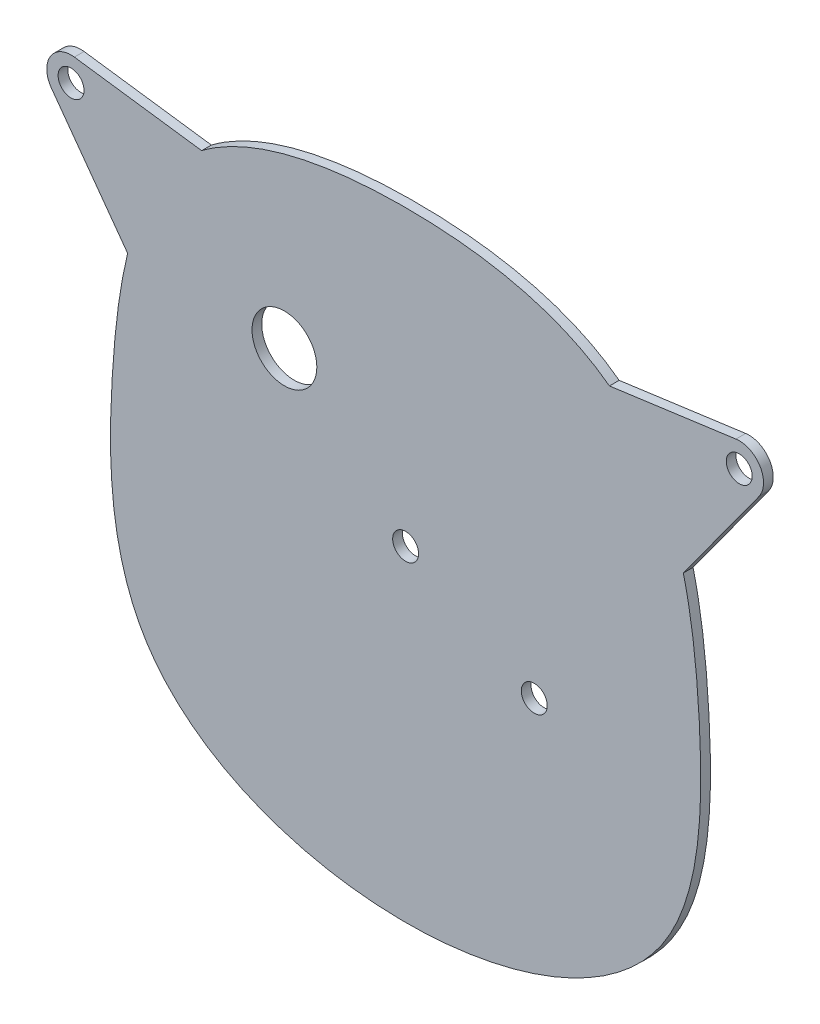
from build123d import *

# Parameters (mm, degrees)
SKETCH_1_R      = 4
SKETCH_1_R_2    = 4.000000012
SKETCH_1_R_3    = 10
EXTRUDE_1_DEPTH = 3


with BuildPart() as part:
    # 草图1 → 凸台-拉伸1 (new body)
    with BuildSketch(Plane.XY):
        with BuildLine():
            Line((-62.946774797, 79.306167048), (-102.215997093, 84.667287467))
            ThreePointArc((-102.215997093, 84.667287467), (-109.667345952, 81.085511319), (-109.297018411, 72.826299631))
            Line((-109.297018411, 72.826299631), (-85.773566925, 40.466210689))
            add(Edge.make_bspline(
                [(85.64855235, 40.771529883), (85.751941961, 40.352602987), (87.358023565, 33.693342831), (88.982133552, 23.461345128), (90.188940434, 10.112723309), (90.998385864, -3.239786605), (91.224047588, -19.81992963), (89.45776693, -35.608509018), (86.289368115, -47.383289507), (82.890059004, -55.67828953), (78.293434935, -63.325052227), (70.539270556, -72.418413989), (58.266934343, -81.71794177), (40.505578091, -89.639515513), (20.741493056, -94.38344306), (-0.025039607, -95.967725873), (-20.791572271, -94.38344306), (-40.555657306, -89.639515513), (-58.317013558, -81.71794177), (-70.589349771, -72.418413989), (-78.34351415, -63.325052227), (-82.940138219, -55.67828953), (-86.339447329, -47.383289507), (-89.507846145, -35.608509018), (-91.274126803, -19.81992963), (-91.048465079, -3.239786605), (-90.239019649, 10.112723309), (-89.032212767, 23.461345128), (-87.425045036, 33.586605521), (-85.851109178, 40.148511531), (-85.773566925, 40.466210689)],
                knots=[1.185395253, 1.185395253, 1.185395253, 1.185395253, 1.1875, 1.21875, 1.234375, 1.25, 1.28125, 1.3125, 1.328125, 1.34375, 1.359375, 1.375, 1.40625, 1.4375, 1.46875, 1.5, 1.53125, 1.5625, 1.59375, 1.625, 1.640625, 1.65625, 1.671875, 1.6875, 1.71875, 1.75, 1.765625, 1.78125, 1.8125, 1.814093804, 1.814093804, 1.814093804, 1.814093804], degree=3))
            Line((85.64855235, 40.771529883), (108.950058788, 72.826299629))
            ThreePointArc((108.950058788, 72.826299629), (109.320386334, 81.085511321), (101.869037469, 84.667287469))
            Line((101.869037469, 84.667287469), (62.85120424, 79.340487236))
            add(Edge.make_bspline(
                [(-62.946774797, 79.306167048), (-60.970021917, 80.799098941), (-53.878326947, 85.444266717), (-39.916439807, 91.111737151), (-20.474972643, 94.85291998), (-6.841683952, 95.560368398), (-0.025039607, 95.560368398), (6.791604738, 95.560368398), (20.424893428, 94.85291998), (39.866360593, 91.111737151), (53.809767438, 85.451768319), (60.887917469, 80.820065563), (62.85120424, 79.340487236)],
                knots=[0.893210136, 0.893210136, 0.893210136, 0.893210136, 0.90625, 0.9375, 0.96875, 1, 1, 1, 1.03125, 1.0625, 1.09375, 1.106689877, 1.106689877, 1.106689877, 1.106689877], degree=3))
        make_face()
        with Locations((-0.025039615, 5.0603684)):
            Circle(SKETCH_1_R, mode=Mode.SUBTRACT)
        with Locations((39.660831238, -15.688736674)):
            Circle(SKETCH_1_R_2, mode=Mode.SUBTRACT)
        with Locations((-103.230502865, 77.236219035)):
            Circle(SKETCH_1_R, mode=Mode.SUBTRACT)
        with Locations((102.883543248, 77.236219038)):
            Circle(SKETCH_1_R, mode=Mode.SUBTRACT)
        with Locations((-37.412572176, 39.236219037)):
            Circle(SKETCH_1_R_3, mode=Mode.SUBTRACT)
    extrude(amount=EXTRUDE_1_DEPTH)


solid = part.part
